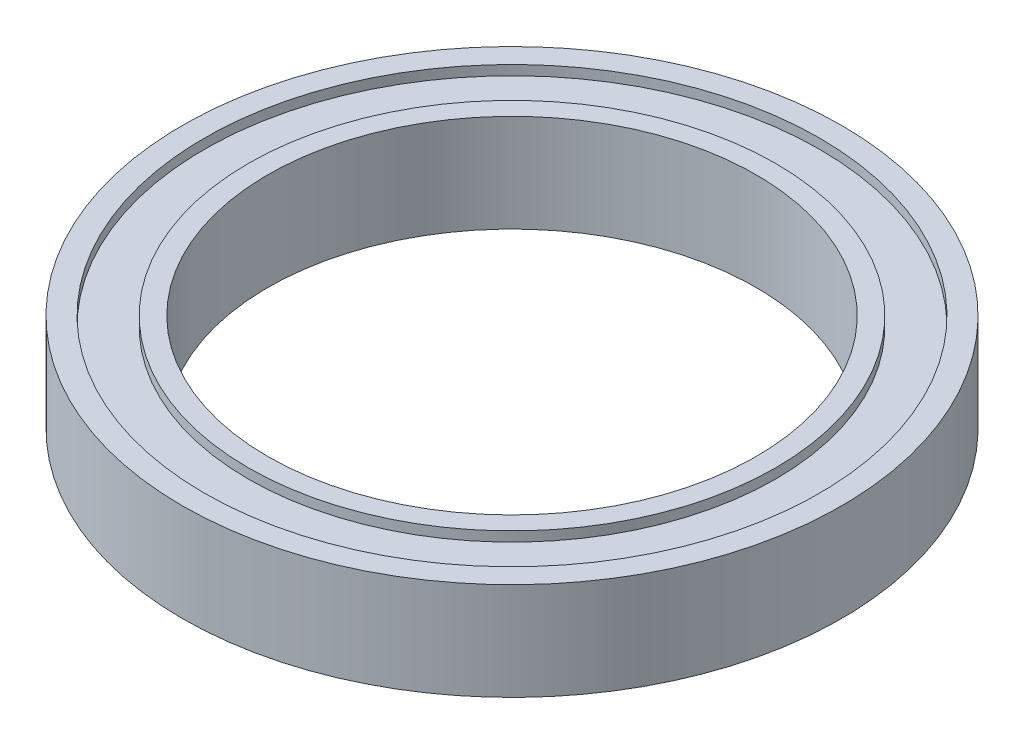
from build123d import *

# Parameters (mm, degrees)
SKETCH1_R           = 13.5
SKETCH1_R_2         = 10
BOSS_EXTRUDE1_DEPTH = 4
SKETCH2_R           = 12.6
SKETCH2_R_2         = 10.8
CUT_EXTRUDE1_DEPTH  = 0.4


with BuildPart() as part:
    # Sketch1 → Boss-Extrude1 (new body)
    with BuildSketch(Plane(origin=(0, 0, 0), x_dir=(1, 0, 0), z_dir=(0, 1, 0))):
        with Locations(Location((0, 0, 0), (0, 0, 270))):
            Circle(SKETCH1_R)
        with Locations(Location((0, 0, 0), (0, 0, 270))):
            Circle(SKETCH1_R_2, mode=Mode.SUBTRACT)
    extrude(amount=BOSS_EXTRUDE1_DEPTH)

    # Sketch2 → Cut-Extrude1 (cut)
    with BuildSketch(Plane(origin=(0, 4, 0), x_dir=(1, 0, 0), z_dir=(0, 1, 0))):
        with Locations(Location((0, 0, 0), (0, 0, 270))):
            Circle(SKETCH2_R)
        with Locations(Location((0, 0, 0), (0, 0, 270))):
            Circle(SKETCH2_R_2, mode=Mode.SUBTRACT)
    cut_extrude1 = extrude(amount=-CUT_EXTRUDE1_DEPTH, mode=Mode.SUBTRACT)

    # Mirror1: Cut-Extrude1 across plane
    add(cut_extrude1.mirror(Plane.ZX.offset(2)), mode=Mode.SUBTRACT)


solid = part.part
